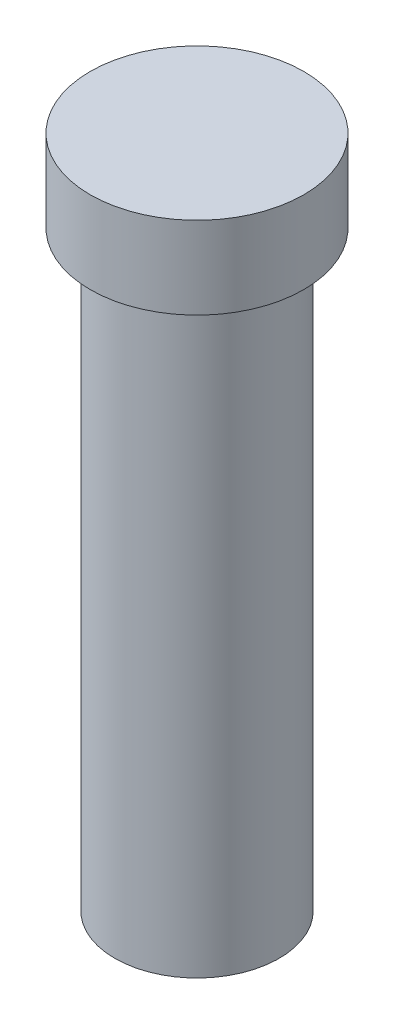
from build123d import *


with BuildPart() as part:
    # Sketch1 → Revolve1 (revolve)
    with BuildSketch(Plane.XY, mode=Mode.PRIVATE) as revolve1_sk:
        Polygon((0, 0), (6.5, 0), (6.5, -5), (5, -5), (5, -41), (0, -41), align=None)
    revolve(revolve1_sk.sketch.rotate(Axis((0, 8.476973089, 0), (0, -1, 0)), 90), axis=Axis((0, 8.476973089, 0), (0, -1, 0)))


solid = part.part
